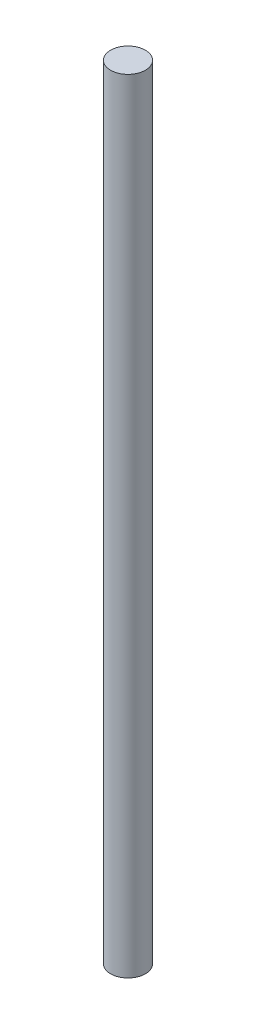
from build123d import *

# Parameters (mm, degrees)
SKETCH1_R           = 2.032
BOSS_EXTRUDE1_DEPTH = 91.44


with BuildPart() as part:
    # Sketch1 → Boss-Extrude1 (new body)
    with BuildSketch(Plane(origin=(0, 0, 0), x_dir=(1, 0, 0), z_dir=(0, 1, 0))):
        with Locations(Location((0, 0, 0), (0, 0, 270))):
            Circle(SKETCH1_R)
    extrude(amount=BOSS_EXTRUDE1_DEPTH)


solid = part.part
